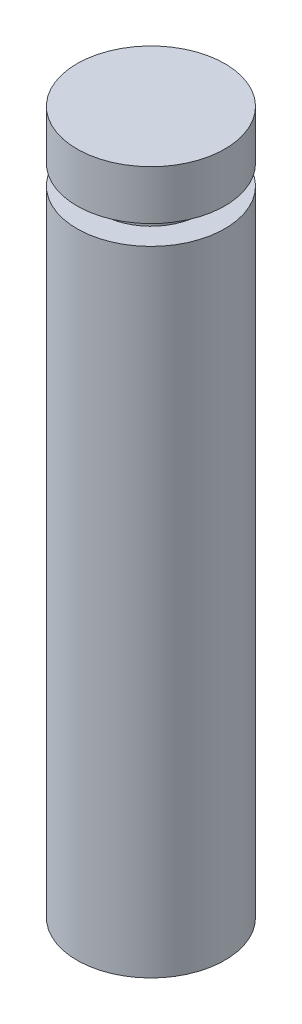
from build123d import *


with BuildPart() as part:
    # Sketch1 → Revolve1 (revolve)
    with BuildSketch(Plane.XY, mode=Mode.PRIVATE) as revolve1_sk:
        Polygon((3, 0), (3, 25.7), (2, 25.7), (2, 26.5), (3, 26.5), (3, 28.5), (0, 28.5), (0, 0), align=None)
    revolve(revolve1_sk.sketch.rotate(Axis((0, 28.5, 0), (0, -1, 0)), 180), axis=Axis((0, 28.5, 0), (0, -1, 0)))


solid = part.part
